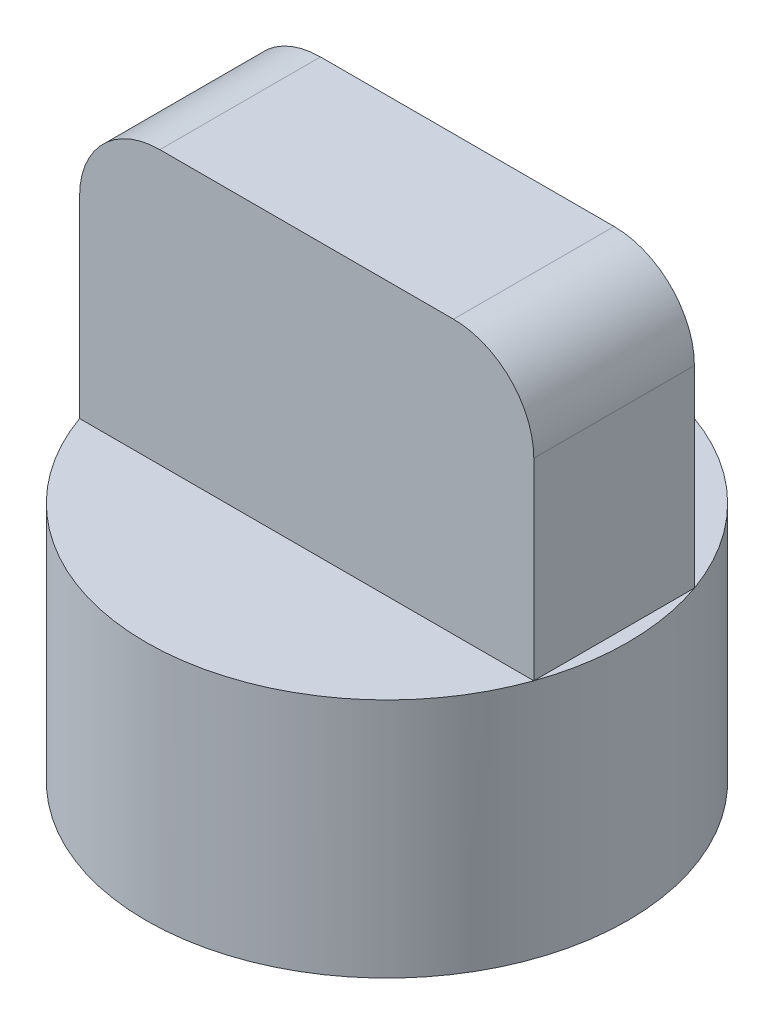
from build123d import *

# Parameters (mm, degrees)
SKETCH1_R           = 15
BOSS_EXTRUDE1_DEPTH = 15
SKETCH4_W           = 28.284271248
SKETCH4_H           = 10
BOSS_EXTRUDE3_DEPTH = 17
FILLET3_R           = 5


with BuildPart() as part:
    # Sketch1 → Boss-Extrude1 (new body)
    with BuildSketch(Plane(origin=(0, 0, 0), x_dir=(1, 0, 0), z_dir=(0, 1, 0))):
        with Locations(Location((0, 0, 0), (0, 0, 270))):
            Circle(SKETCH1_R)
    extrude(amount=-BOSS_EXTRUDE1_DEPTH)

    # Sketch4 → Boss-Extrude3 (add)
    with BuildSketch(Plane(origin=(0, 0, 0), x_dir=(1, 0, 0), z_dir=(0, 1, 0))):
        Rectangle(SKETCH4_W, SKETCH4_H)
    extrude(amount=BOSS_EXTRUDE3_DEPTH)

    # Fillet3
    fillet3_edges = [part.edges().sort_by_distance(p)[0] for p in [
        (-14.142135624, 17, 0),
        (14.142135624, 17, 0),
    ]]
    fillet(fillet3_edges, radius=FILLET3_R)


solid = part.part
